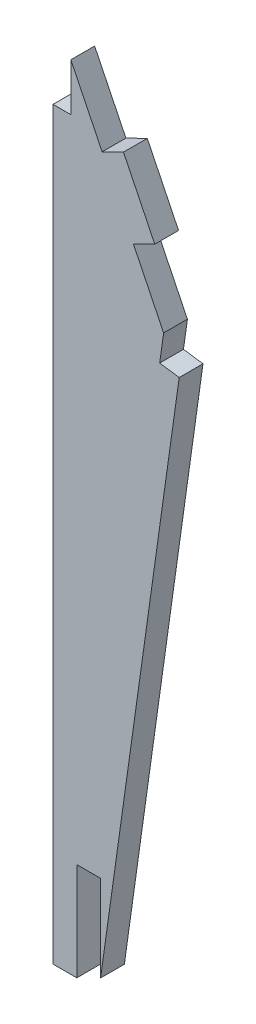
from build123d import *

# Parameters (mm, degrees)
EXTRUDE_1_DEPTH = 2


with BuildPart() as part:
    # 草图1 → 凸台-拉伸1 (new body)
    with BuildSketch(Plane.XY):
        Polygon((17.343451833, 74.702795301), (17.343451833, 70.702795301), (15.843451833, 70.702795301), (15.843451833, 8.08014643), (17.843451833, 8.08014643), (17.843451833, 16.33014643), (19.843451833, 16.33014643), (19.843451833, 9.068454854), (26.45635308, 56.114347005), (24.814803102, 56.345538126), (25.146877684, 58.703401304), (22.603905595, 63.917266745), (24.401493687, 64.794009039), (21.771266806, 70.186773317), (19.973678714, 69.310031023), align=None)
    extrude(amount=EXTRUDE_1_DEPTH)


solid = part.part
